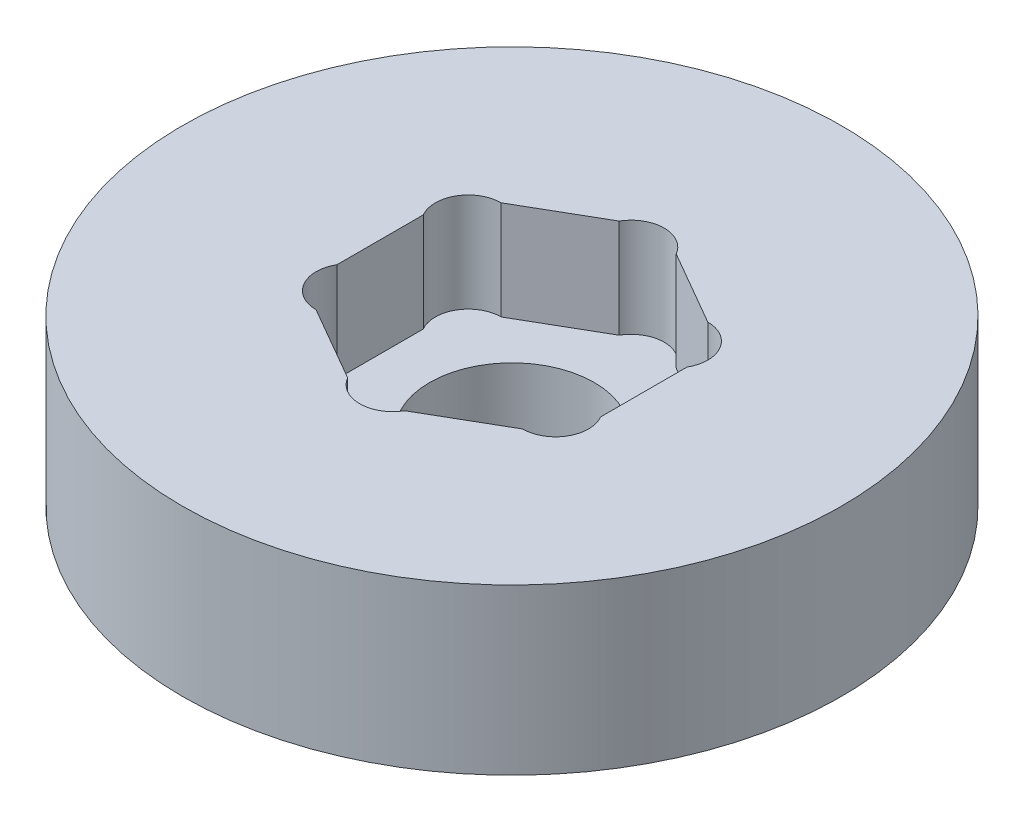
from build123d import *

# Parameters (mm, degrees)
SKETCH_1_R          = 10
EXTRUDE_1_DEPTH     = 5
CUT_EXTRUDE_1_DEPTH = 3
SKETCH_3_R          = 1
CUT_EXTRUDE_2_DEPTH = 3
SKETCH_5_R          = 2.5
CUT_EXTRUDE_3_DEPTH = 3


with BuildPart() as part:
    # 스케치1 → 보스-돌출1 (new body)
    with BuildSketch(Plane(origin=(0, 0, 0), x_dir=(1, 0, 0), z_dir=(0, 1, 0))):
        with Locations(Location((0, 0, 0), (0, 0, 270))):
            Circle(SKETCH_1_R)
    extrude(amount=EXTRUDE_1_DEPTH)

    # 스케치2 → 컷-돌출1 (cut)
    with BuildSketch(Plane(origin=(0, 5, 0), x_dir=(1, 0, 0), z_dir=(0, 1, 0))):
        Polygon((0, 4.618802154), (-4, 2.309401077), (-4, -2.309401077), (0, -4.618802154), (4, -2.309401077), (4, 2.309401077), align=None)
    extrude(amount=-CUT_EXTRUDE_1_DEPTH, mode=Mode.SUBTRACT)

    # 스케치3 → 컷-돌출2 (cut)
    with BuildSketch(Plane(origin=(0, 5, 0), x_dir=(1, 0, 0), z_dir=(0, 1, 0))):
        with Locations((0, 3.618802154)):
            Circle(SKETCH_3_R)
        with Locations((3.133974596, 1.809401077)):
            Circle(SKETCH_3_R)
        with Locations((3.133974596, -1.809401077)):
            Circle(SKETCH_3_R)
        with Locations((0, -3.618802154)):
            Circle(SKETCH_3_R)
        with Locations((-3.133974596, -1.809401077)):
            Circle(SKETCH_3_R)
        with Locations((-3.133974596, 1.809401077)):
            Circle(SKETCH_3_R)
    extrude(amount=-CUT_EXTRUDE_2_DEPTH, mode=Mode.SUBTRACT)

    # 스케치5 → 컷-돌출3 (cut)
    with BuildSketch(Plane.XZ):
        with Locations(Location((0, 0, 0), (0, 0, 270))):
            Circle(SKETCH_5_R)
    extrude(amount=-CUT_EXTRUDE_3_DEPTH, mode=Mode.SUBTRACT)


solid = part.part
